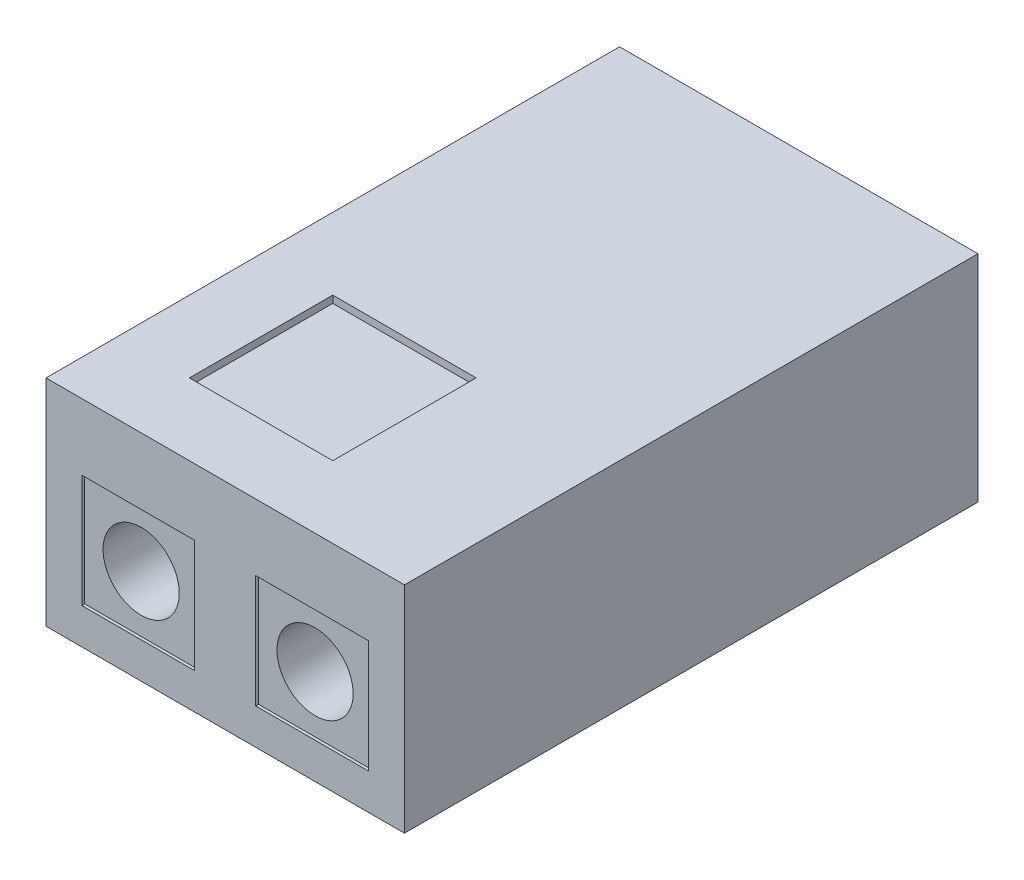
from build123d import *

# Parameters (mm, degrees)
SKETCH1_W           = 63.5
SKETCH1_H           = 101.6
BOSS_EXTRUDE1_DEPTH = 38.1
SKETCH2_R           = 6.75
CUT_EXTRUDE1_DEPTH  = 38.1
SKETCH2_3_W         = 20
SKETCH2_3_H         = 20
SKETCH2_3_R         = 6.75
CUT_EXTRUDE2_DEPTH  = 0.508
SKETCH3_R           = 3.81
SKETCH3_W           = 10.16
SKETCH3_H           = 6.35
SKETCH3_W_2         = 12.7
CUT_EXTRUDE3_DEPTH  = 9.525
SKETCH5_W           = 25.4
SKETCH5_H           = 25.4
CUT_EXTRUDE4_DEPTH  = 1.27


with BuildPart() as part:
    # Sketch1 → Boss-Extrude1 (new body)
    with BuildSketch(Plane(origin=(0, 0, 0), x_dir=(1, 0, 0), z_dir=(0, 1, 0))):
        with Locations((-14.643877551, 9.719387755)):
            Rectangle(SKETCH1_W, SKETCH1_H)
    extrude(amount=BOSS_EXTRUDE1_DEPTH)

    # Sketch2 → Cut-Extrude1 (cut)
    with BuildSketch(Plane.XY.offset(41.080612245)):
        with Locations((-30.043877551, 16.35)):
            Circle(SKETCH2_R)
        with Locations((0.756122449, 16.35)):
            Circle(SKETCH2_R)
    extrude(amount=-CUT_EXTRUDE1_DEPTH, mode=Mode.SUBTRACT)

    # Sketch2<3> → Cut-Extrude2 (cut)
    # profile 1 of 2: a face of its own
    with BuildSketch(Plane.XY.offset(41.080612245)):
        with Locations((-30.043877551, 16.35)):
            Rectangle(SKETCH2_3_W, SKETCH2_3_H)
        with Locations((-30.043877551, 16.35)):
            Circle(SKETCH2_3_R, mode=Mode.SUBTRACT)
    # profile 2 of 2: a face of its own
    with BuildSketch(Plane.XY.offset(41.080612245)):
        with Locations((0.756122449, 16.35)):
            Rectangle(SKETCH2_3_W, SKETCH2_3_H)
        with Locations((0.756122449, 16.35)):
            Circle(SKETCH2_3_R, mode=Mode.SUBTRACT)
    extrude(amount=-CUT_EXTRUDE2_DEPTH, mode=Mode.SUBTRACT)

    # Sketch3 → Cut-Extrude3 (cut)
    with BuildSketch(Plane(origin=(0, 0, -60.519387755), x_dir=(-1, 0, 0), z_dir=(0, 0, -1))):
        with Locations((13.373877551, 12.7)):
            Circle(SKETCH3_R)
        with Locations((28.613877551, 22.225)):
            Rectangle(SKETCH3_W, SKETCH3_H)
        with Locations((-4.406122449, 9.525)):
            Rectangle(SKETCH3_W_2, SKETCH3_H)
    extrude(amount=-CUT_EXTRUDE3_DEPTH, mode=Mode.SUBTRACT)

    # Sketch5 → Cut-Extrude4 (cut)
    with BuildSketch(Plane(origin=(0, 38.1, 0), x_dir=(1, 0, 0), z_dir=(0, 1, 0))):
        with Locations((-20.993877551, -15.680612245)):
            Rectangle(SKETCH5_W, SKETCH5_H)
    extrude(amount=-CUT_EXTRUDE4_DEPTH, mode=Mode.SUBTRACT)


solid = part.part
